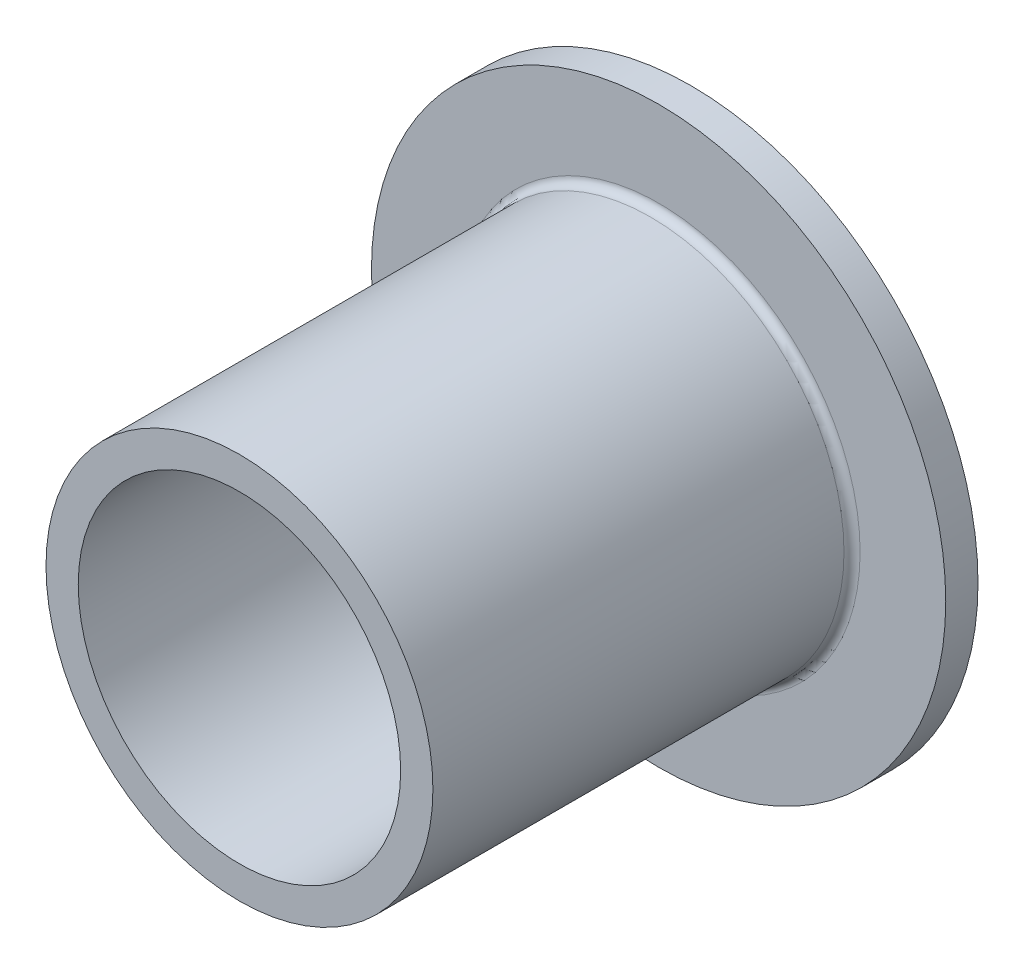
from build123d import *

# Parameters (mm, degrees)
SKETCH1_R           = 35.625
SKETCH1_R_2         = 20
BOSS_EXTRUDE1_DEPTH = 4
SKETCH2_R           = 24
SKETCH2_R_2         = 20
BOSS_EXTRUDE2_DEPTH = 52
FILLET1_R           = 1


with BuildPart() as part:
    # Sketch1 → Boss-Extrude1 (new body)
    with BuildSketch(Plane.XY):
        Circle(SKETCH1_R)
        Circle(SKETCH1_R_2, mode=Mode.SUBTRACT)
    extrude(amount=BOSS_EXTRUDE1_DEPTH)

    # Sketch2 → Boss-Extrude2 (add)
    with BuildSketch(Plane.XY.offset(4)):
        with Locations(Location((0, 0, 0), (0, 0, 180))):
            Circle(SKETCH2_R)
        Circle(SKETCH2_R_2, mode=Mode.SUBTRACT)
    extrude(amount=BOSS_EXTRUDE2_DEPTH)

    # Fillet1
    fillet1_edges = [part.edges().sort_by_distance(p)[0] for p in [
        (24, 0, 4),
    ]]
    fillet(fillet1_edges, radius=FILLET1_R)


solid = part.part
